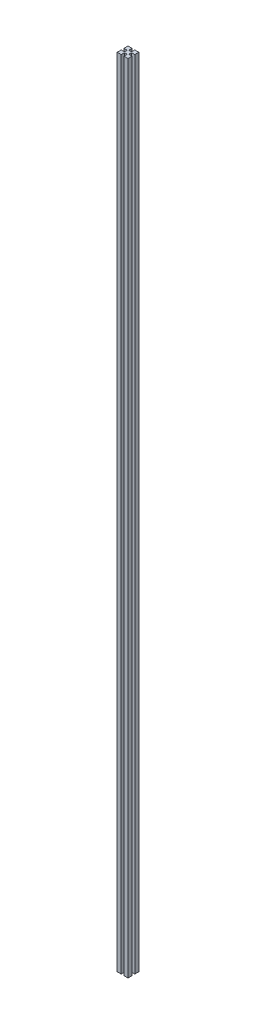
from build123d import *

# Parameters (mm, degrees)
BOSS_EXTRUDE1_DEPTH      = 736.6
BOSS_EXTRUDE1_DEPTH_BACK = 736.6
SKETCH1_W                = 20
SKETCH1_H                = 20
CUT_EXTRUDE1_DEPTH       = 737.735746384
CUT_EXTRUDE1_DEPTH_BACK  = 737.735746384
SKETCH2_W                = 5
SKETCH2_H                = 12
SKETCH2_W_2              = 12
SKETCH2_H_2              = 5


with BuildPart() as part:
    # Sketch1 → Boss-Extrude1 (new, two sides: drawn at the far end of the back side and taken through both)
    with BuildSketch(Plane(origin=(0, 0, 0), x_dir=(1, 0, 0), z_dir=(0, 1, 0)).offset(-BOSS_EXTRUDE1_DEPTH_BACK)):
        Rectangle(SKETCH1_W, SKETCH1_H)
    extrude(amount=BOSS_EXTRUDE1_DEPTH + BOSS_EXTRUDE1_DEPTH_BACK)

    # Sketch2 → Cut-Extrude1 (cut, two sides: drawn at the far end of the back side and taken through both)
    with BuildSketch(Plane(origin=(0, 0, 0), x_dir=(1, 0, 0), z_dir=(0, 1, 0)).offset(-CUT_EXTRUDE1_DEPTH_BACK)):
        with Locations((0, 10)):
            Rectangle(SKETCH2_W, SKETCH2_H)
        with Locations((10, 0)):
            Rectangle(SKETCH2_W_2, SKETCH2_H_2)
        with Locations((-10, 0)):
            Rectangle(SKETCH2_W_2, SKETCH2_H_2)
        with Locations((0, -10)):
            Rectangle(SKETCH2_W, SKETCH2_H)
    extrude(amount=CUT_EXTRUDE1_DEPTH + CUT_EXTRUDE1_DEPTH_BACK, mode=Mode.SUBTRACT)


solid = part.part
